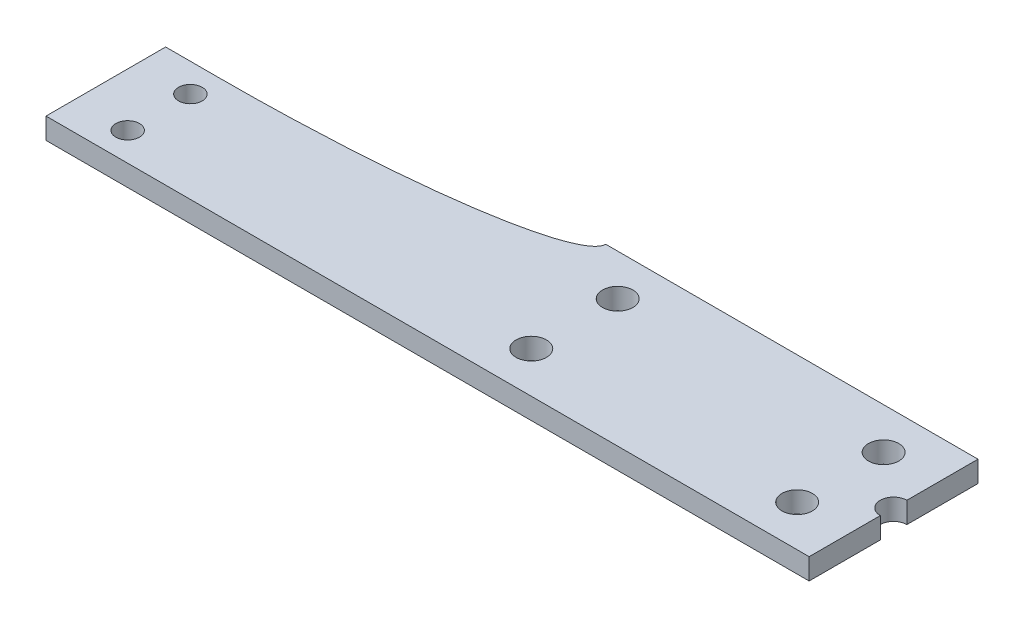
from build123d import *

# Parameters (mm, degrees)
SKETCH1_R           = 0.89
SKETCH1_R_2         = 1.143
BOSS_EXTRUDE1_DEPTH = 1.5875


with BuildPart() as part:
    # Sketch1 → Boss-Extrude1 (new body)
    with BuildSketch(Plane(origin=(0, 0, 0), x_dir=(1, 0, 0), z_dir=(0, 1, 0))):
        with BuildLine():
            Line((-26.7, -6.35), (26.7, -6.35))
            Line((26.7, -6.35), (26.7, -1))
            ThreePointArc((26.7, -1), (25.7, 0), (26.7, 1))
            Line((26.7, 1), (26.7, 6.35))
            Line((26.7, 6.35), (-1.3, 6.35))
            add(Edge.make_bspline(
                [(-26.7, 2.65), (-1.3, 2.65), (-1.3, 6.35)],
                knots=[4.71238898, 4.71238898, 4.71238898, 6.283185307, 6.283185307, 6.283185307], degree=2, weights=[1, 0.707106781, 1]))
            Line((-26.7, 2.65), (-30.7, 2.65))
            Line((-30.7, 2.65), (-30.7, -6.35))
            Line((-30.7, -6.35), (-26.7, -6.35))
        make_face()
        with Locations(Location((-26.7, 0.51, 0), (0, 0, 270))):
            Circle(SKETCH1_R, mode=Mode.SUBTRACT)
        with Locations(Location((-26.7, -4.21, 0), (0, 0, 270))):
            Circle(SKETCH1_R, mode=Mode.SUBTRACT)
        with Locations(Location((2.7, 3.25, 0), (0, 0, 270))):
            Circle(SKETCH1_R_2, mode=Mode.SUBTRACT)
        with Locations(Location((2.7, -3.25, 0), (0, 0, 270))):
            Circle(SKETCH1_R_2, mode=Mode.SUBTRACT)
        with Locations(Location((22.7, 3.25, 0), (0, 0, 270))):
            Circle(SKETCH1_R_2, mode=Mode.SUBTRACT)
        with Locations(Location((22.7, -3.25, 0), (0, 0, 270))):
            Circle(SKETCH1_R_2, mode=Mode.SUBTRACT)
    extrude(amount=BOSS_EXTRUDE1_DEPTH)


solid = part.part
